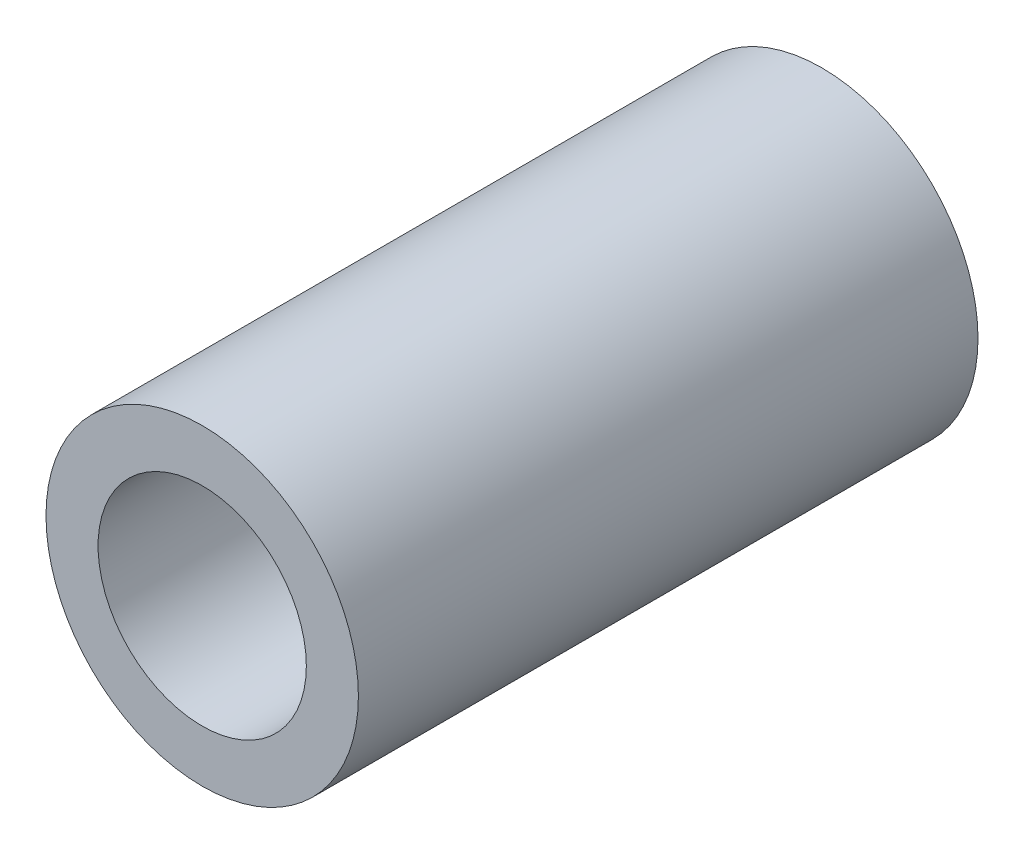
from build123d import *

# Parameters (mm, degrees)
SKETCH_1_R      = 3
SKETCH_1_R_2    = 2
EXTRUDE_1_DEPTH = 11.9


with BuildPart() as part:
    # ｽｹｯﾁ1 → ﾎﾞｽ - 押し出し1 (new body)
    with BuildSketch(Plane.XY):
        Circle(SKETCH_1_R)
        Circle(SKETCH_1_R_2, mode=Mode.SUBTRACT)
    extrude(amount=EXTRUDE_1_DEPTH)


solid = part.part
